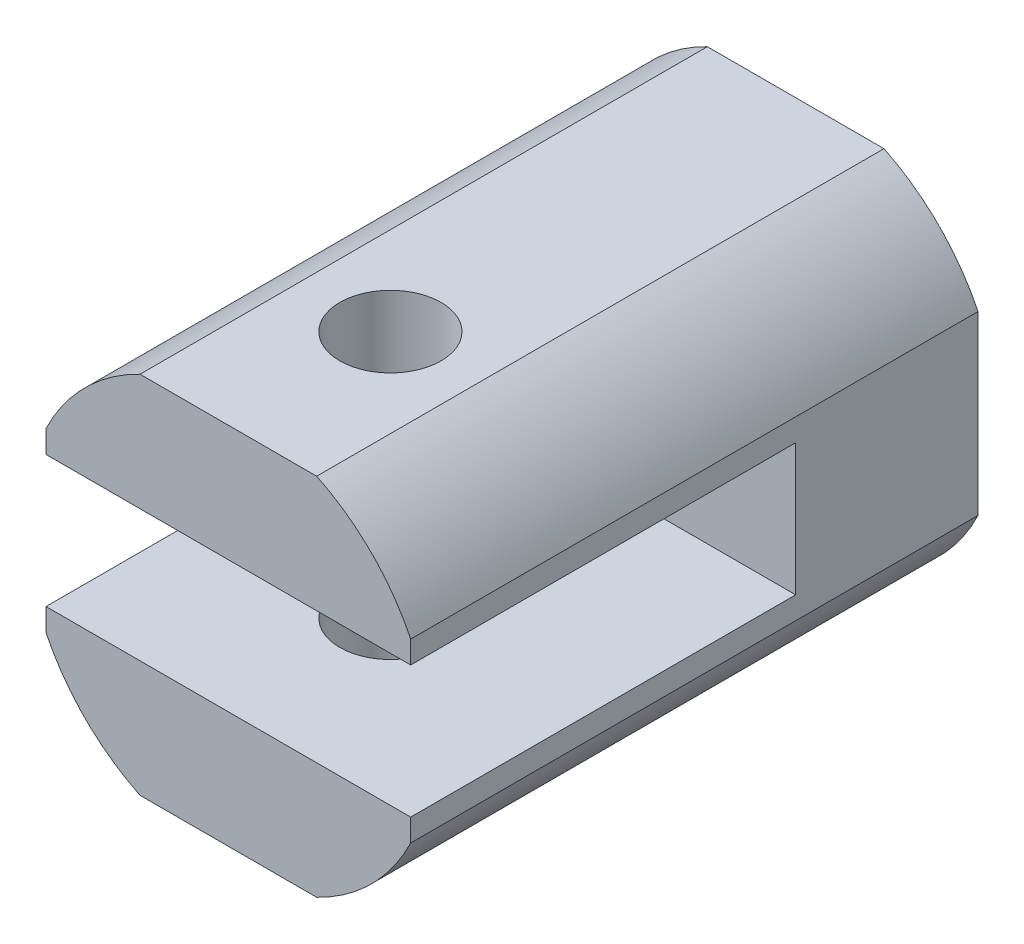
from build123d import *

# Parameters (mm, degrees)
BOSS_EXTRUDE2_DEPTH      = 28
SKETCH3_W                = 18
SKETCH3_H                = 6.5
CUT_EXTRUDE9_DEPTH       = 19
CUT_EXTRUDE10_DEPTH      = 31.757112998
CUT_EXTRUDE10_DEPTH_BACK = 31.757112998
SKETCH4_R                = 2.5


with BuildPart() as part:
    # Sketch1 → Boss-Extrude2 (new body)
    with BuildSketch(Plane.XY):
        with BuildLine():
            Line((-4.358898944, 9), (4.358898944, 9))
            ThreePointArc((4.358898944, 9), (7.071067812, 7.071067812), (9, 4.358898944))
            Line((9, 4.358898944), (9, -4.358898944))
            ThreePointArc((9, -4.358898944), (7.071067812, -7.071067812), (4.358898944, -9))
            Line((4.358898944, -9), (-4.358898944, -9))
            ThreePointArc((-4.358898944, -9), (-7.071067812, -7.071067812), (-9, -4.358898944))
            Line((-9, -4.358898944), (-9, 4.358898944))
            ThreePointArc((-9, 4.358898944), (-7.071067812, 7.071067812), (-4.358898944, 9))
        make_face()
    extrude(amount=-BOSS_EXTRUDE2_DEPTH)

    # Sketch3 → Cut-Extrude9 (cut)
    with BuildSketch(Plane.XY):
        Rectangle(SKETCH3_W, SKETCH3_H)
    extrude(amount=-CUT_EXTRUDE9_DEPTH, mode=Mode.SUBTRACT)

    # Sketch4 → Cut-Extrude10 (cut, two sides: drawn at the far end of the back side and taken through both)
    with BuildSketch(Plane(origin=(0, 0, 0), x_dir=(1, 0, 0), z_dir=(0, 1, 0)).offset(-CUT_EXTRUDE10_DEPTH_BACK)):
        with Locations(Location((0, 8, 0), (0, 0, 270))):
            Circle(SKETCH4_R)
    extrude(amount=CUT_EXTRUDE10_DEPTH + CUT_EXTRUDE10_DEPTH_BACK, mode=Mode.SUBTRACT)


solid = part.part
